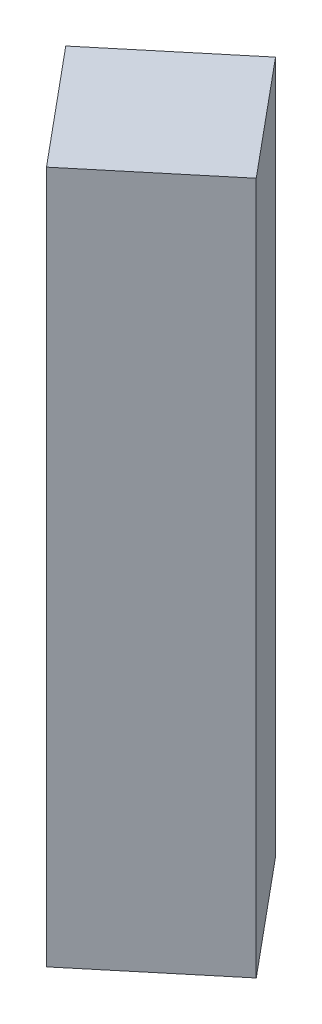
from build123d import *

# Parameters (mm, degrees)
BOSS_EXTRU_1_DEPTH = 465


with BuildPart() as part:
    # Esquisse1 → Boss.-Extru.1 (new body)
    with BuildSketch(Plane(origin=(0, 0, 0), x_dir=(1, 0, 0), z_dir=(0, 1, 0))):
        Polygon((-6.470141505, -70.414041703), (70.414041703, -6.470141505), (6.470141505, 70.414041703), (-70.414041703, 6.470141505), align=None)
    extrude(amount=BOSS_EXTRU_1_DEPTH)


solid = part.part
